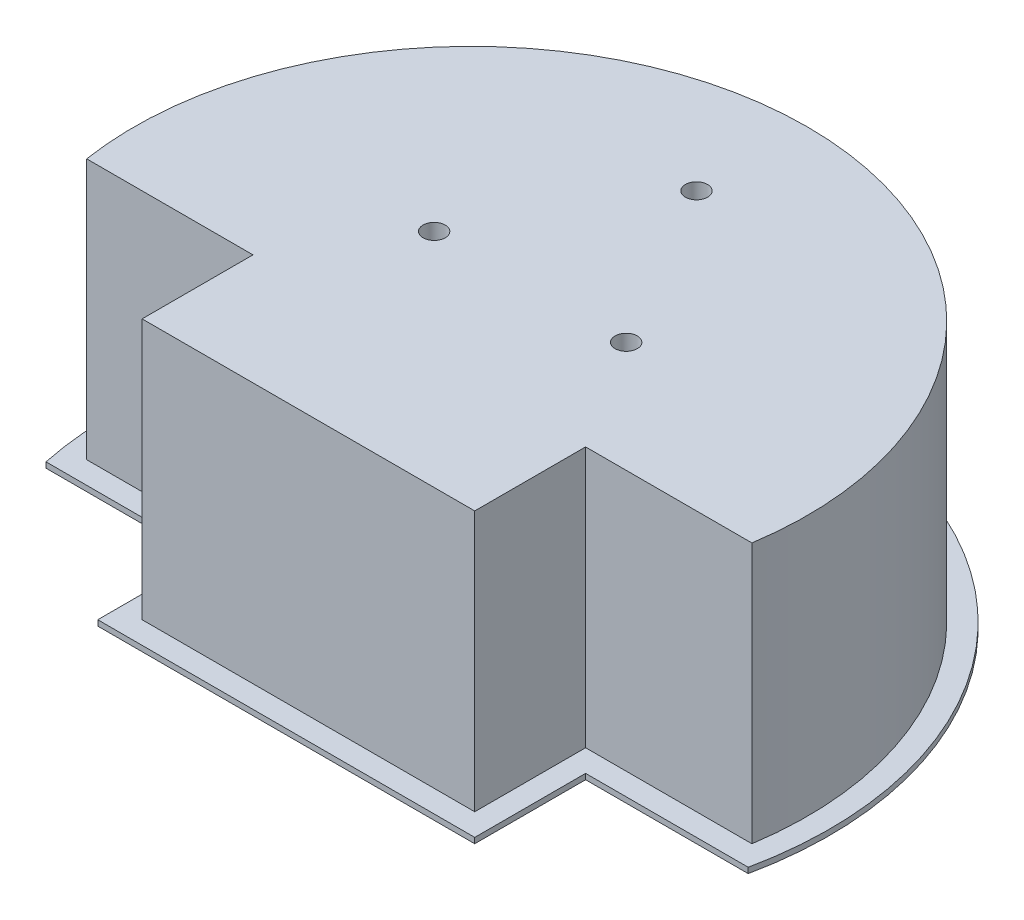
from build123d import *

# Parameters (mm, degrees)
EXTRUIR_L_MINA1_DEPTH   = 20
SALIENTE_EXTRUIR1_DEPTH = 4
CROQUIS3_R              = 2.1
CORTAR_EXTRUIR2_DEPTH   = 2.2
SALIENTE_EXTRUIR3_DEPTH = 0.5
CROQUIS5_R              = 1
CORTAR_EXTRUIR3_DEPTH   = 10


with BuildPart() as part:
    # Croquis1 → Extruir-Lámina1 (new body)
    with BuildSketch(Plane(origin=(0, 0, 0), x_dir=(1, 0, 0), z_dir=(0, 1, 0))):
        with BuildLine():
            Line((-30, 10), (-15, 10))
            Line((-15, 10), (-15, 0))
            Line((-15, 0), (15, 0))
            Line((15, 0), (15, 10))
            Line((15, 10), (30, 10))
            ThreePointArc((30, 10), (0, 45), (-30, 10))
        make_face()
        with BuildLine():
            Line((-28.233718443, 12), (-13, 12))
            Line((-13, 12), (-13, 2))
            Line((-13, 2), (13, 2))
            Line((13, 2), (13, 12))
            Line((13, 12), (28.233718443, 12))
            ThreePointArc((28.233718443, 12), (0, 43), (-28.233718443, 12))
        make_face(mode=Mode.SUBTRACT)
    extrude(amount=EXTRUIR_L_MINA1_DEPTH)

    # Croquis2 → Saliente-Extruir1 (add)
    with BuildSketch(Plane(origin=(0, 20, 0), x_dir=(1, 0, 0), z_dir=(0, 1, 0))):
        with BuildLine():
            Line((15, 10), (30, 10))
            ThreePointArc((30, 10), (0, 45), (-30, 10))
            Line((-30, 10), (-15, 10))
            Line((-15, 10), (-15, 0))
            Line((-15, 0), (15, 0))
            Line((15, 0), (15, 10))
        make_face()
    extrude(amount=SALIENTE_EXTRUIR1_DEPTH)

    # Croquis3 → Cortar-Extruir2 (cut)
    with BuildSketch(Plane.XZ.offset(-20)):
        with Locations(Location((-8.660254038, -20, 0), (0, 0, 270))):
            Circle(CROQUIS3_R)
        with Locations(Location((8.660254038, -20, 0), (0, 0, 270))):
            Circle(CROQUIS3_R)
        with Locations(Location((0, -35, 0), (0, 0, 270))):
            Circle(CROQUIS3_R)
    extrude(amount=-CORTAR_EXTRUIR2_DEPTH, mode=Mode.SUBTRACT)

    # Croquis4 → Saliente-Extruir3 (add)
    with BuildSketch(Plane.XZ):
        with BuildLine():
            Line((17, 2), (-17, 2))
            Line((-17, 2), (-17, -8))
            Line((-17, -8), (-31.667919775, -8))
            ThreePointArc((-31.667919775, -8), (0, -47), (31.667919775, -8))
            Line((31.667919775, -8), (17, -8))
            Line((17, -8), (17, 2))
        make_face()
        with BuildLine():
            Line((13, -12), (28.233718443, -12))
            ThreePointArc((28.233718443, -12), (0, -43), (-28.233718443, -12))
            Line((-28.233718443, -12), (-13, -12))
            Line((-13, -12), (-13, -2))
            Line((-13, -2), (13, -2))
            Line((13, -2), (13, -12))
        make_face(mode=Mode.SUBTRACT)
    extrude(amount=-SALIENTE_EXTRUIR3_DEPTH)

    # Croquis5 → Cortar-Extruir3 (cut)
    with BuildSketch(Plane.XZ.offset(-20)):
        with Locations(Location((-8.660254038, -20, 0), (0, 0, 270))):
            Circle(CROQUIS5_R)
        with Locations(Location((8.660254038, -20, 0), (0, 0, 270))):
            Circle(CROQUIS5_R)
        with Locations(Location((0, -35, 0), (0, 0, 270))):
            Circle(CROQUIS5_R)
    extrude(amount=-CORTAR_EXTRUIR3_DEPTH, mode=Mode.SUBTRACT)


solid = part.part
